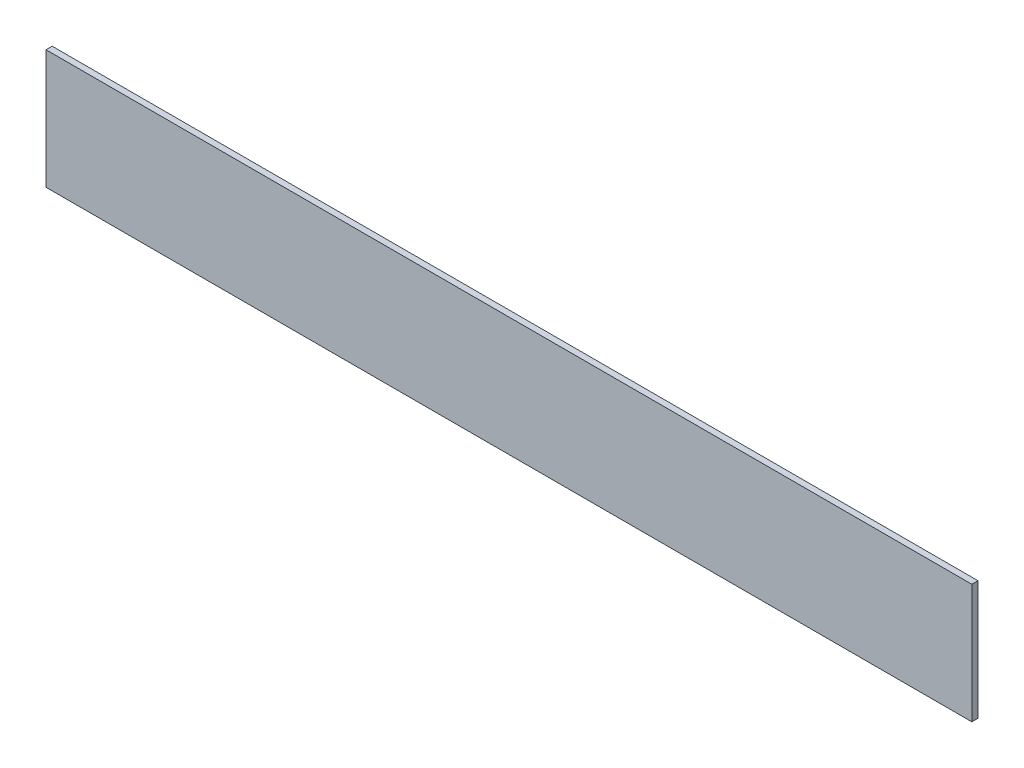
from build123d import *

# Parameters (mm, degrees)
SKETCH1_W           = 150
SKETCH1_H           = 19.3
BOSS_EXTRUDE1_DEPTH = 1


with BuildPart() as part:
    # Sketch1 → Boss-Extrude1 (new body)
    with BuildSketch(Plane.XY):
        with Locations((-75, 0)):
            Rectangle(SKETCH1_W, SKETCH1_H)
    extrude(amount=BOSS_EXTRUDE1_DEPTH)


solid = part.part
